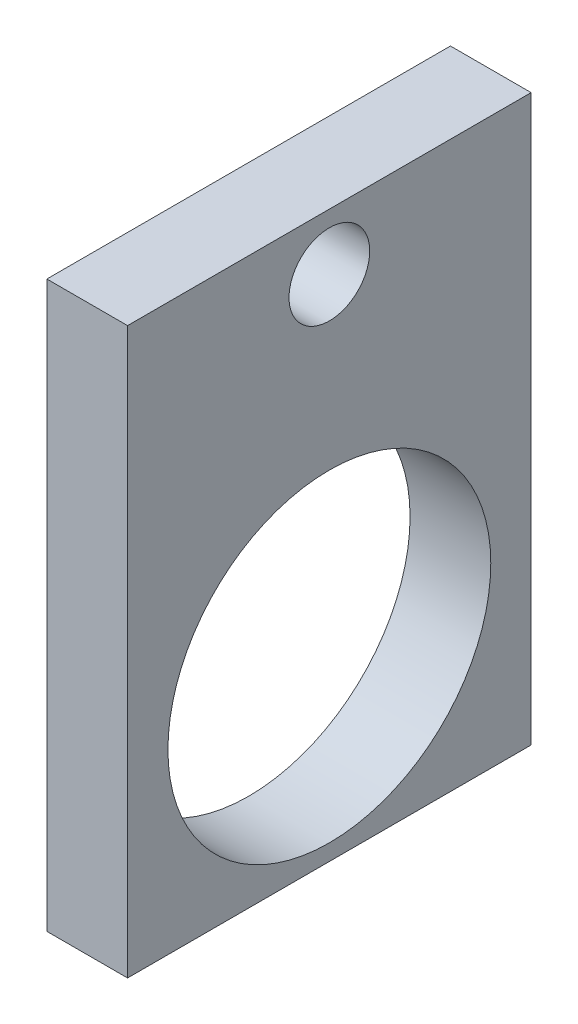
from build123d import *

# Parameters (mm, degrees)
SKETCH1_W           = 31.75
SKETCH1_H           = 44.45
SKETCH1_R           = 12.7
SKETCH1_R_2         = 3.175
BOSS_EXTRUDE1_DEPTH = 6.35


with BuildPart() as part:
    # Sketch1 → Boss-Extrude1 (new body)
    with BuildSketch(Plane(origin=(0, 0, 0), x_dir=(0, 0, -1), z_dir=(1, 0, 0))):
        Rectangle(SKETCH1_W, SKETCH1_H)
        with Locations((0, -8.255)):
            Circle(SKETCH1_R, mode=Mode.SUBTRACT)
        with Locations((0, 17.78)):
            Circle(SKETCH1_R_2, mode=Mode.SUBTRACT)
    extrude(amount=BOSS_EXTRUDE1_DEPTH)


solid = part.part
